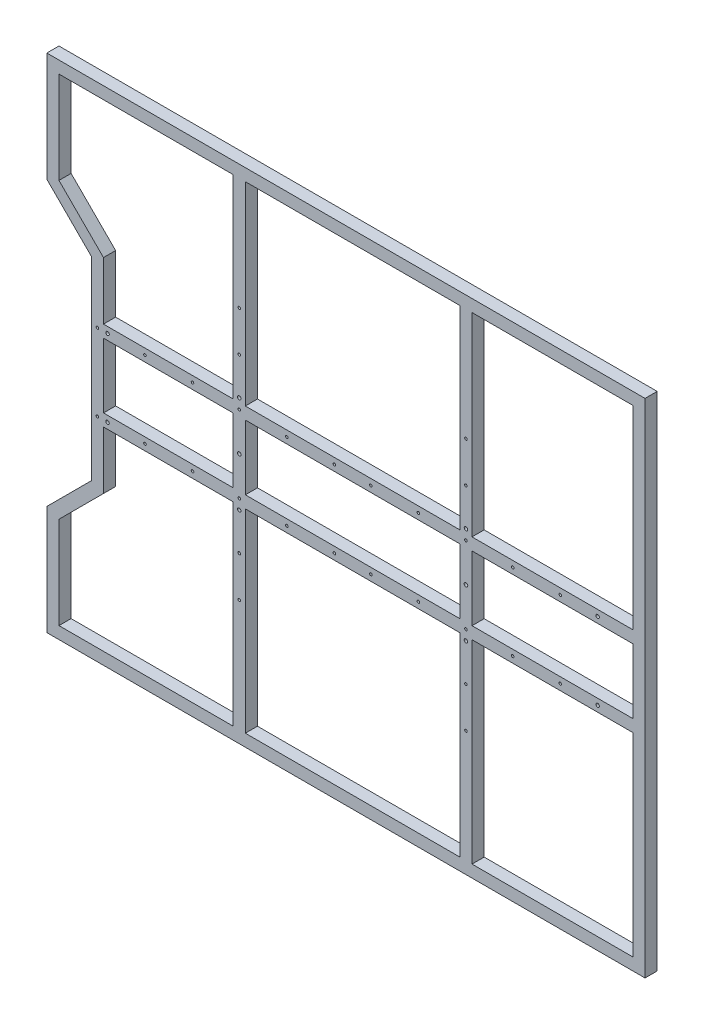
from build123d import *

# Parameters (mm, degrees)
SKETCH_2_W          = 160.200177837
SKETCH_2_H          = 80
SKETCH_2_W_2        = 198.700177837
SKETCH_2_H_2        = 240
SKETCH_2_W_3        = 265
EXTRUDE_1_DEPTH     = 15
SKETCH_3_R          = 2.15
SKETCH_3_R_2        = 1.6
SKETCH_3_R_3        = 2.240696867
CUT_EXTRUDE_1_DEPTH = 15


with BuildPart() as part:
    # 草图2 → 凸台-拉伸1 (new body)
    with BuildSketch(Plane.XY):
        Polygon((-377.700177837, 310), (361.200177837, 310), (361.200177837, 40), (361.200177837, -40), (361.200177837, -310), (-377.700177837, -310), (-377.700177837, -175), (-322.700177837, -120), (-322.700177837, -40), (-322.700177837, 40), (-322.700177837, 120), (-377.700177837, 175), align=None)
        Polygon((-362.700177837, 295), (-147.5, 295), (-147.5, 55), (-307.700177837, 55), (-307.700177837, 126.213203436), (-362.700177837, 181.213203436), align=None, mode=Mode.SUBTRACT)
        with Locations((-227.600088919, 0)):
            Rectangle(SKETCH_2_W, SKETCH_2_H, mode=Mode.SUBTRACT)
        with Locations((246.850088919, 175)):
            Rectangle(SKETCH_2_W_2, SKETCH_2_H_2, mode=Mode.SUBTRACT)
        with Locations((0, 175)):
            Rectangle(SKETCH_2_W_3, SKETCH_2_H_2, mode=Mode.SUBTRACT)
        with Locations((246.850088919, -175)):
            Rectangle(SKETCH_2_W_2, SKETCH_2_H_2, mode=Mode.SUBTRACT)
        with Locations((0, -175)):
            Rectangle(SKETCH_2_W_3, SKETCH_2_H_2, mode=Mode.SUBTRACT)
        Polygon((-307.700177837, -126.213203436), (-307.700177837, -55), (-147.5, -55), (-147.5, -295), (-362.700177837, -295), (-362.700177837, -181.213203436), align=None, mode=Mode.SUBTRACT)
        Rectangle(SKETCH_2_W_3, SKETCH_2_H, mode=Mode.SUBTRACT)
        with Locations((246.850088919, 0)):
            Rectangle(SKETCH_2_W_2, SKETCH_2_H, mode=Mode.SUBTRACT)
    extrude(amount=EXTRUDE_1_DEPTH)

    # 草图3 → 切除-拉伸1 (cut)
    with BuildSketch(Plane.XY.offset(15)):
        with Locations((-140, 60)):
            Circle(SKETCH_3_R)
        with Locations((-315.200177837, 47.5)):
            Circle(SKETCH_3_R_2)
        with Locations((-256.466844504, 47.5)):
            Circle(SKETCH_3_R_2)
        with Locations((-197.736844504, 47.5)):
            Circle(SKETCH_3_R_2)
        with Locations((-140, 47.5)):
            Circle(SKETCH_3_R_2)
        with Locations((-140, 156.23)):
            Circle(SKETCH_3_R_2)
        with Locations((-140, 106.23)):
            Circle(SKETCH_3_R_2)
        with Locations((-81.27, 47.5)):
            Circle(SKETCH_3_R_2)
        with Locations((-22.54, 47.5)):
            Circle(SKETCH_3_R_2)
        with Locations((-140, 0)):
            Circle(SKETCH_3_R_3)
        with Locations((-302.700177837, 47.5)):
            Circle(SKETCH_3_R)
        with Locations(Location((-302.700177837, -47.5, 0), (0, 0, 180))):
            Circle(SKETCH_3_R)
        with Locations(Location((-22.54, -47.5, 0), (0, 0, 180))):
            Circle(SKETCH_3_R_2)
        with Locations(Location((-81.27, -47.5, 0), (0, 0, 180))):
            Circle(SKETCH_3_R_2)
        with Locations(Location((-140, -106.23, 0), (0, 0, 180))):
            Circle(SKETCH_3_R_2)
        with Locations(Location((-140, -156.23, 0), (0, 0, 180))):
            Circle(SKETCH_3_R_2)
        with Locations(Location((-140, -47.5, 0), (0, 0, 180))):
            Circle(SKETCH_3_R_2)
        with Locations(Location((-197.736844504, -47.5, 0), (0, 0, 180))):
            Circle(SKETCH_3_R_2)
        with Locations(Location((-256.466844504, -47.5, 0), (0, 0, 180))):
            Circle(SKETCH_3_R_2)
        with Locations(Location((-315.200177837, -47.5, 0), (0, 0, 180))):
            Circle(SKETCH_3_R_2)
        with Locations(Location((-140, -60, 0), (0, 0, 180))):
            Circle(SKETCH_3_R)
        with Locations((140, -60)):
            Circle(SKETCH_3_R)
        with Locations((256.466844504, -47.5)):
            Circle(SKETCH_3_R_2)
        with Locations((197.736844504, -47.5)):
            Circle(SKETCH_3_R_2)
        with Locations((140, -47.5)):
            Circle(SKETCH_3_R_2)
        with Locations((140, -156.23)):
            Circle(SKETCH_3_R_2)
        with Locations((140, -106.23)):
            Circle(SKETCH_3_R_2)
        with Locations((81.27, -47.5)):
            Circle(SKETCH_3_R_2)
        with Locations((22.54, -47.5)):
            Circle(SKETCH_3_R_2)
        with Locations((302.700177837, -47.5)):
            Circle(SKETCH_3_R)
        with Locations(Location((302.700177837, 47.5, 0), (0, 0, 180))):
            Circle(SKETCH_3_R)
        with Locations(Location((140, 0, 0), (0, 0, 180))):
            Circle(SKETCH_3_R_3)
        with Locations(Location((22.54, 47.5, 0), (0, 0, 180))):
            Circle(SKETCH_3_R_2)
        with Locations(Location((81.27, 47.5, 0), (0, 0, 180))):
            Circle(SKETCH_3_R_2)
        with Locations(Location((140, 106.23, 0), (0, 0, 180))):
            Circle(SKETCH_3_R_2)
        with Locations(Location((140, 156.23, 0), (0, 0, 180))):
            Circle(SKETCH_3_R_2)
        with Locations(Location((140, 47.5, 0), (0, 0, 180))):
            Circle(SKETCH_3_R_2)
        with Locations(Location((197.736844504, 47.5, 0), (0, 0, 180))):
            Circle(SKETCH_3_R_2)
        with Locations(Location((256.466844504, 47.5, 0), (0, 0, 180))):
            Circle(SKETCH_3_R_2)
        with Locations(Location((140, 60, 0), (0, 0, 180))):
            Circle(SKETCH_3_R)
    extrude(amount=-CUT_EXTRUDE_1_DEPTH, mode=Mode.SUBTRACT)


solid = part.part
